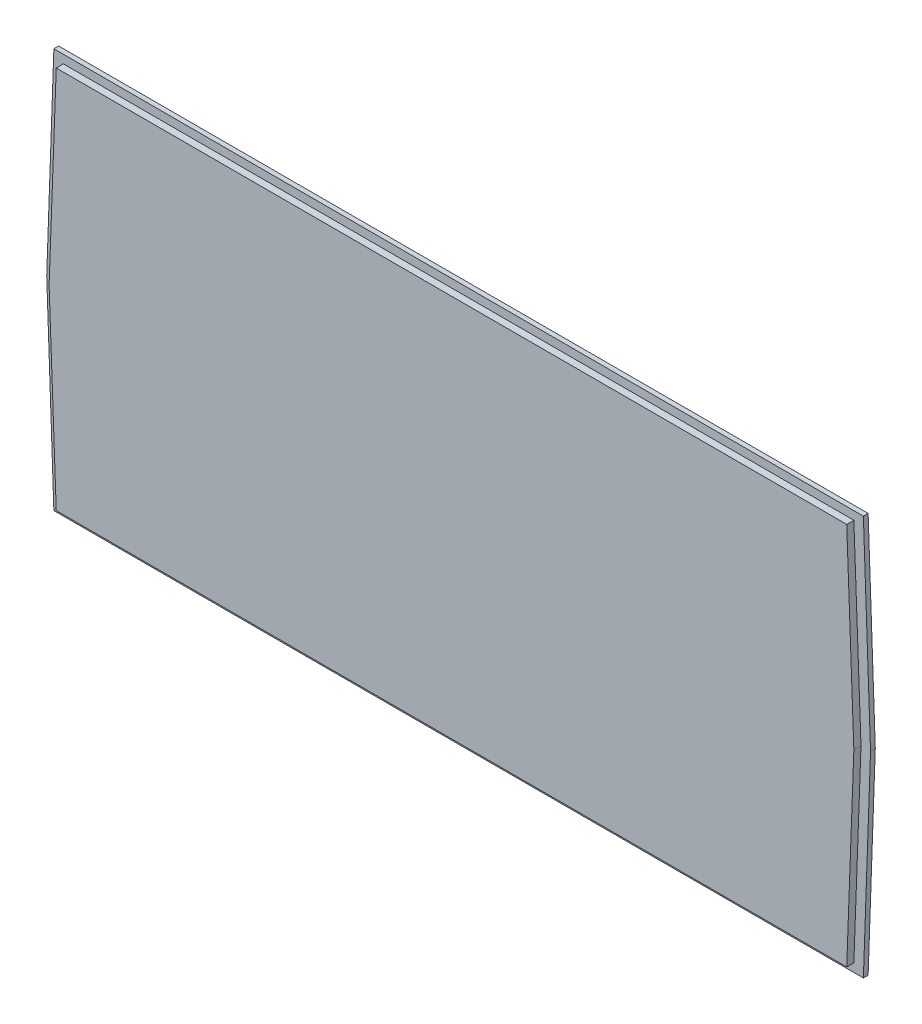
from build123d import *

# Parameters (mm, degrees)
BOSS_EXTRUDE1_DEPTH = 1
BOSS_EXTRUDE2_DEPTH = 1.5


with BuildPart() as part:
    # Sketch1 → Boss-Extrude1 (new body)
    with BuildSketch(Plane.XY):
        Polygon((-85, 42), (85, 42), (86.5, 0), (85, -42), (-85, -42), (-86.5, 0), align=None)
    extrude(amount=BOSS_EXTRUDE1_DEPTH)

    # Sketch2 → Boss-Extrude2 (add)
    with BuildSketch(Plane.XY.offset(1)):
        Polygon((-83, 40.25), (83, 40.25), (84.5, 0), (83, -40.25), (-83, -40.25), (-84.5, 0), align=None)
    extrude(amount=BOSS_EXTRUDE2_DEPTH)


solid = part.part
